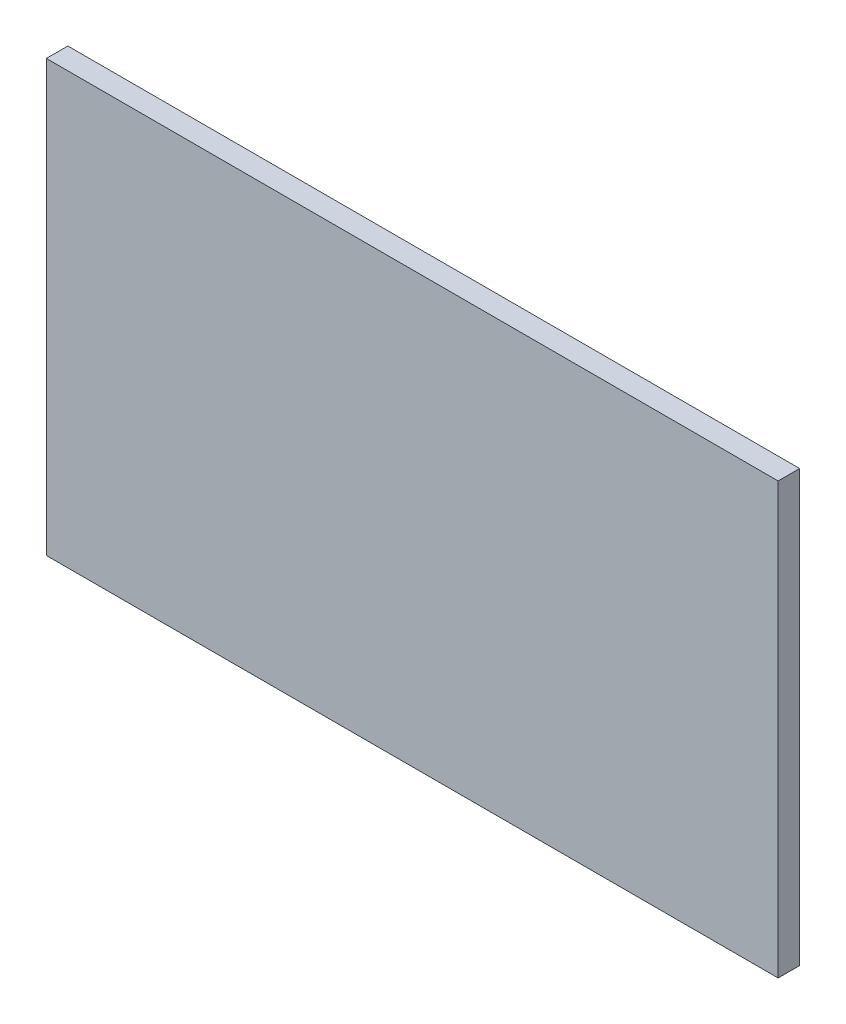
from build123d import *

# Parameters (mm, degrees)
SKETCH_1_W      = 340
SKETCH_1_H      = 200
EXTRUDE_1_DEPTH = 10


with BuildPart() as part:
    # 草图1 → 凸台-拉伸1 (new body)
    with BuildSketch(Plane.XY):
        Rectangle(SKETCH_1_W, SKETCH_1_H)
    extrude(amount=EXTRUDE_1_DEPTH)


solid = part.part
